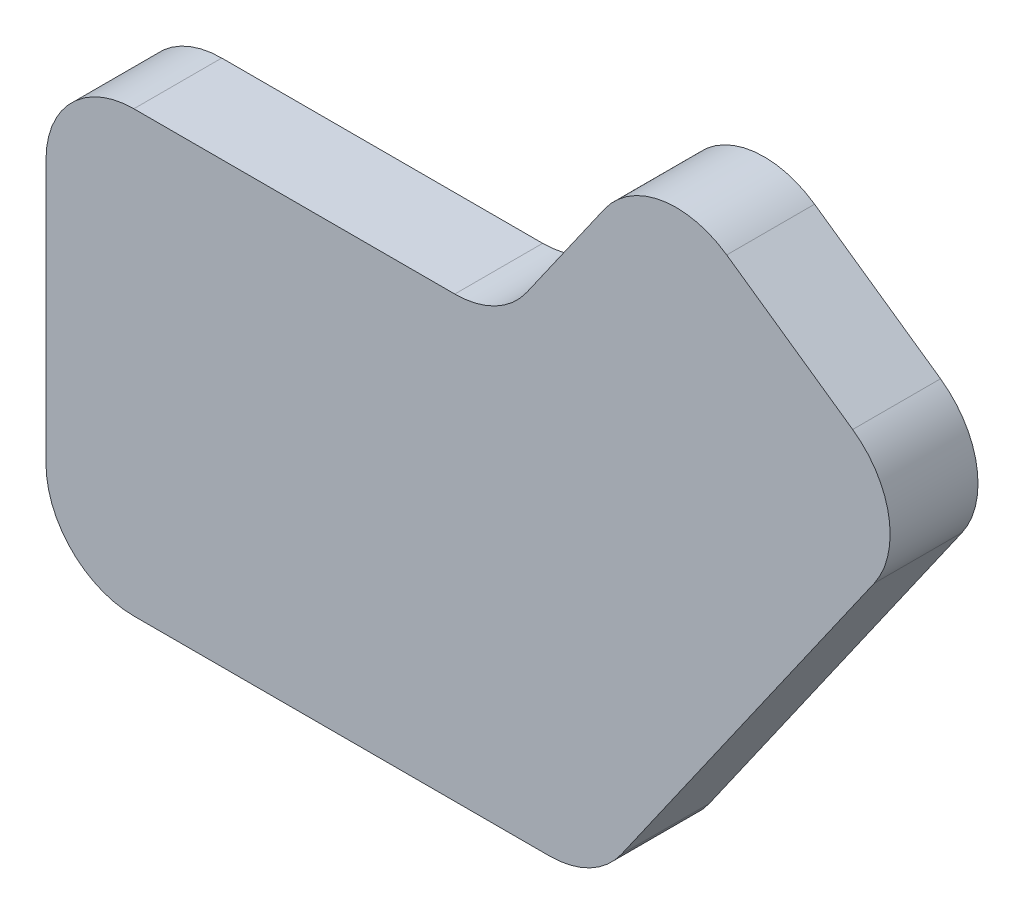
from build123d import *

# Parameters (mm, degrees)
BOSS_EXTRUDE1_DEPTH = 20
FILLET1_R           = 20


with BuildPart() as part:
    # Sketch1 → Boss-Extrude1 (new body)
    with BuildSketch(Plane.XY):
        Polygon((0, 0), (-125, 0), (-125, 100), (-21.537340336, 100), (13.563596678, 150.129333232), (75, 107.111100506), align=None)
    extrude(amount=BOSS_EXTRUDE1_DEPTH)

    # Fillet1
    fillet1_edges = [part.edges().sort_by_distance(p)[0] for p in [
        (0, 0, 10),
        (-125, 0, 10),
        (-125, 100, 10),
        (-21.537340336, 100, 10),
        (13.563596678, 150.129333232, 10),
        (75, 107.111100506, 10),
    ]]
    fillet(fillet1_edges, radius=FILLET1_R)


solid = part.part
